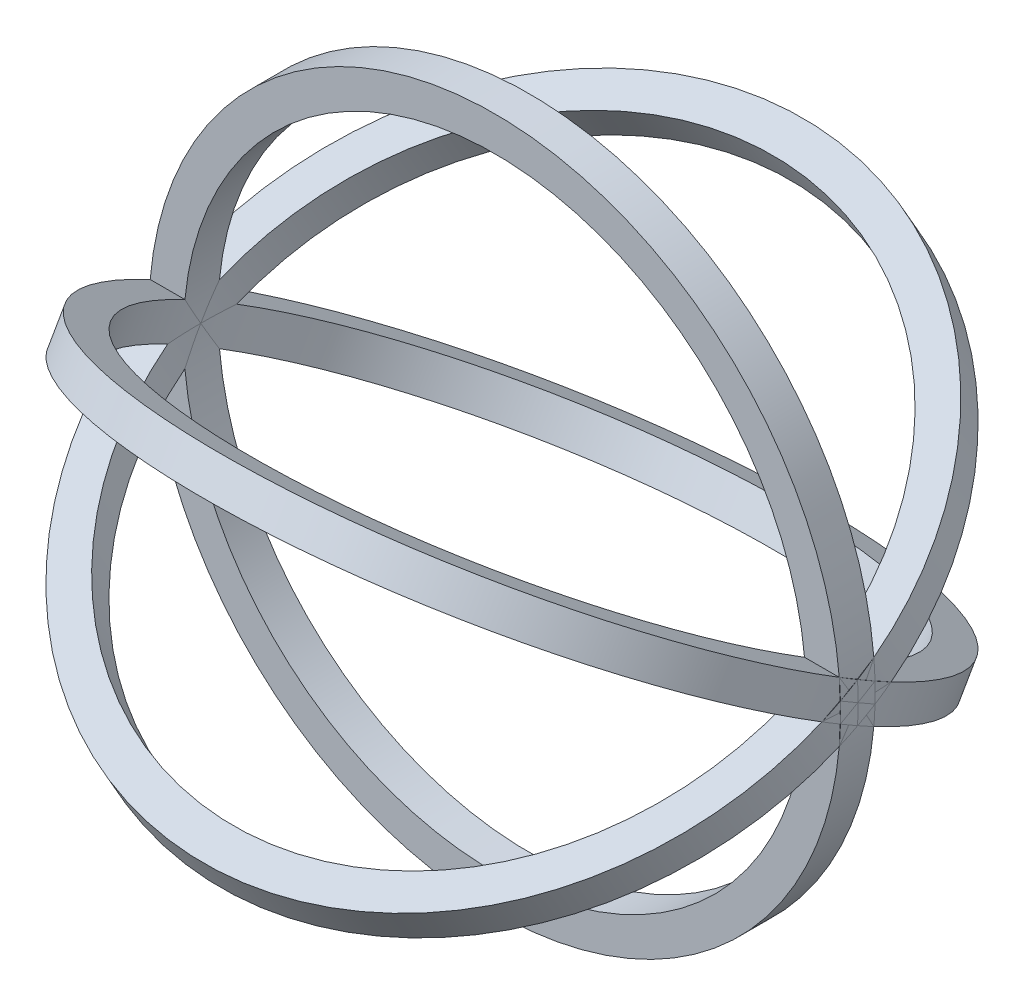
from build123d import *

# Parameters (mm, degrees)
SKETCH1_R           = 15
SKETCH1_R_2         = 13.5
BOSS_EXTRUDE1_DEPTH = 0.75
CIRPATTERN1_COUNT   = 6


with BuildPart() as part:
    # Sketch1 → Boss-Extrude1 (new, symmetric)
    with BuildSketch(Plane.XY):
        Circle(SKETCH1_R)
        Circle(SKETCH1_R_2, mode=Mode.SUBTRACT)
    boss_extrude1 = extrude(amount=BOSS_EXTRUDE1_DEPTH, both=True)

    # CirPattern1: Boss-Extrude1 ×6 about axis
    cirpattern1_axis = Axis((16.5, 0, 0), (-1, 0, 0))
    for i in range(1, CIRPATTERN1_COUNT):
        add(boss_extrude1.rotate(cirpattern1_axis, i * 360 / CIRPATTERN1_COUNT))


solid = part.part
